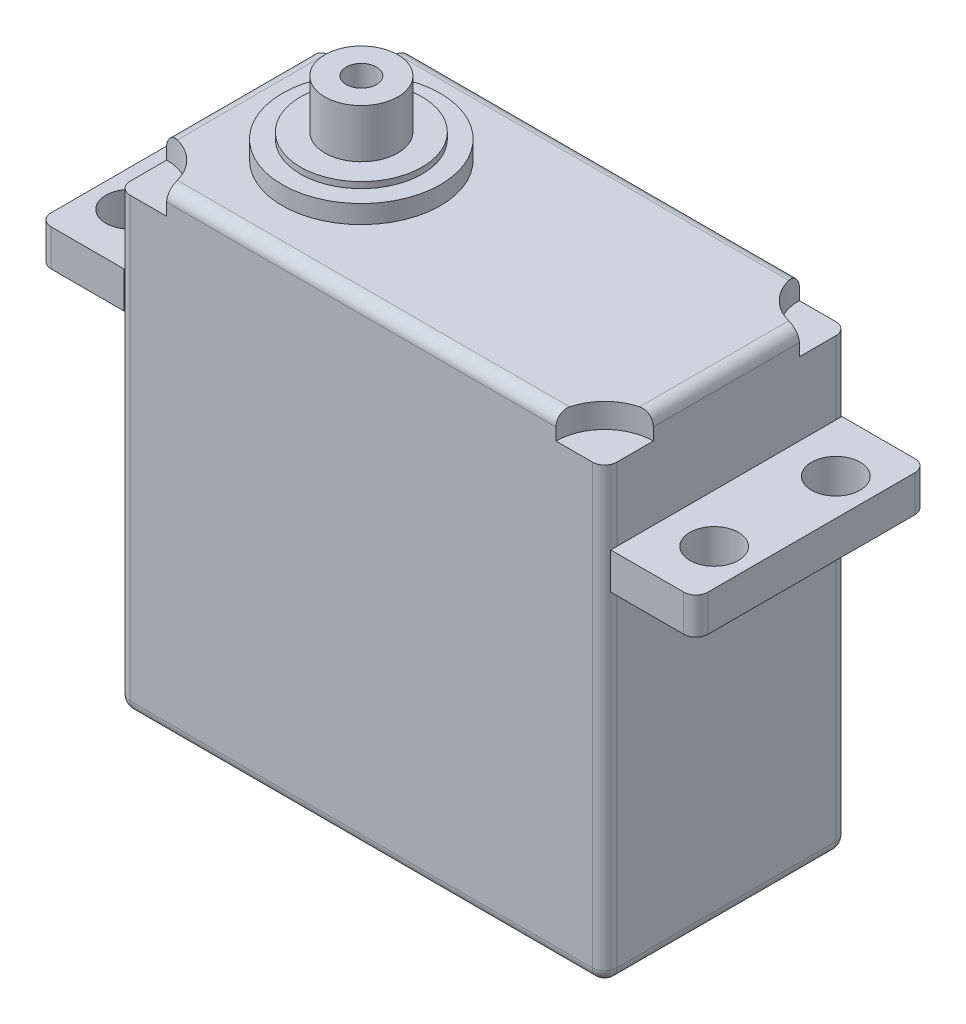
from build123d import *

# Parameters (mm, degrees)
SKETCH_2_W                = 40
SKETCH_2_H                = 39
EXTRUDE_1_DEPTH           = 10
FILLET_1_R                = 1
SKETCH_6_R                = 4
CUT_EXTRUDE_1_DEPTH       = 2
HOLE_WIZARD_2_0_2_2_D     = 2
HOLE_WIZARD_2_0_2_2_DEPTH = 10
HOLE_WIZARD_2_0_2_2_TIP   = 0.600860619
EXTRUDE_START             = -8
SKETCH_16_W               = 7
SKETCH_16_H               = 19
SKETCH_16_R               = 2
EXTRUDE_2_DEPTH           = 3
SKETCH_17_R               = 6.5
EXTRUDE_3_DEPTH           = 1.5
SKETCH_18_R               = 5
EXTRUDE_4_DEPTH           = 0.5
SKETCH_19_R               = 3
EXTRUDE_5_DEPTH           = 4
FILLET_2_R                = 1
HOLE_WIZARD_M3_1_D        = 2.5
HOLE_WIZARD_M3_1_DEPTH    = 5.55
HOLE_WIZARD_M3_1_TIP      = 0.751075774


with BuildPart() as part:
    # 草图2 → 凸台-拉伸1 (new, symmetric)
    with BuildSketch(Plane.XY):
        with Locations((20, -19.5)):
            Rectangle(SKETCH_2_W, SKETCH_2_H)
    extrude(amount=EXTRUDE_1_DEPTH, both=True)

    # 圆角1
    fillet_1_edges = [part.edges().sort_by_distance(p)[0] for p in [
        (40, -19.5, 10),
        (20, 0, 10),
        (0, -19.5, 10),
        (20, 0, -10),
        (40, -19.5, -10),
        (20, -39, -10),
        (0, -19.5, -10),
        (20, -39, 10),
        (0, 0, 0),
        (40, 0, 0),
        (40, -39, 0),
        (0, -39, 0),
    ]]
    fillet(fillet_1_edges, radius=FILLET_1_R)

    # 草图6 → 切除-拉伸1 (cut)
    with BuildSketch(Plane.XZ):
        with Locations((0, 10)):
            Circle(SKETCH_6_R)
        with Locations((40, 10)):
            Circle(SKETCH_6_R)
        with Locations((40, -10)):
            Circle(SKETCH_6_R)
        with Locations((0, -10)):
            Circle(SKETCH_6_R)
    extrude(amount=CUT_EXTRUDE_1_DEPTH, mode=Mode.SUBTRACT)

    # Ø2.0 (2) 直径孔2
    with Locations(Plane(origin=(0, -39, 0), x_dir=(-1, 0, 0), z_dir=(0, -1, 0))):
        with Locations((-37.5, 7.5), (-37.5, -7.5), (-2.5, 7.5), (-2.5, -7.5)):
            Hole(HOLE_WIZARD_2_0_2_2_D / 2, depth=HOLE_WIZARD_2_0_2_2_DEPTH)
            with Locations((0, 0, -(HOLE_WIZARD_2_0_2_2_DEPTH + HOLE_WIZARD_2_0_2_2_TIP / 2))):  # 118° drill point
                Cone(0, HOLE_WIZARD_2_0_2_2_D / 2, HOLE_WIZARD_2_0_2_2_TIP, mode=Mode.SUBTRACT)

    # 草图16 → 凸台-拉伸2 (add)
    # profile 1 of 2: a face of its own
    with BuildSketch(Plane(origin=(0, 0, 0), x_dir=(1, 0, 0), z_dir=(0, 1, 0)).offset(EXTRUDE_START)):
        with Locations((-3.5, 0)):
            Rectangle(SKETCH_16_W, SKETCH_16_H)
        with Locations(Location((-4, -5, 0), (0, 0, 270))):
            Circle(SKETCH_16_R, mode=Mode.SUBTRACT)
        with Locations(Location((-4, 5, 0), (0, 0, 270))):
            Circle(SKETCH_16_R, mode=Mode.SUBTRACT)
    # profile 2 of 2: a face of its own
    with BuildSketch(Plane(origin=(0, 0, 0), x_dir=(1, 0, 0), z_dir=(0, 1, 0)).offset(EXTRUDE_START)):
        with Locations((43.5, 0)):
            Rectangle(SKETCH_16_W, SKETCH_16_H)
        with Locations(Location((44, 5, 0), (0, 0, 90))):
            Circle(SKETCH_16_R, mode=Mode.SUBTRACT)
        with Locations(Location((44, -5, 0), (0, 0, 90))):
            Circle(SKETCH_16_R, mode=Mode.SUBTRACT)
    extrude(amount=-EXTRUDE_2_DEPTH)

    # 草图17 → 凸台-拉伸3 (add)
    with BuildSketch(Plane(origin=(0, 0, 0), x_dir=(1, 0, 0), z_dir=(0, 1, 0))):
        with Locations(Location((10, 0, 0), (0, 0, 90))):
            Circle(SKETCH_17_R)
    extrude(amount=EXTRUDE_3_DEPTH)

    # 草图18 → 凸台-拉伸4 (add)
    with BuildSketch(Plane(origin=(0, 1.5, 0), x_dir=(1, 0, 0), z_dir=(0, 1, 0))):
        with Locations(Location((10, 0, 0), (0, 0, 270))):
            Circle(SKETCH_18_R)
    extrude(amount=EXTRUDE_4_DEPTH)

    # 草图19 → 凸台-拉伸5 (add)
    with BuildSketch(Plane(origin=(0, 2, 0), x_dir=(1, 0, 0), z_dir=(0, 1, 0))):
        with Locations(Location((10, 0, 0), (0, 0, 270))):
            Circle(SKETCH_19_R)
    extrude(amount=EXTRUDE_5_DEPTH)

    # 圆角2
    fillet_2_edges = [part.edges().sort_by_distance(p)[0] for p in [
        (-7, -9.5, 9.5),
        (-7, -9.5, -9.5),
        (47, -9.5, 9.5),
        (47, -9.5, -9.5),
    ]]
    fillet(fillet_2_edges, radius=FILLET_2_R)

    # M3 螺纹孔1
    with Locations(Plane(origin=(0, 6, 0), x_dir=(1, 0, 0), z_dir=(0, 1, 0))):
        with Locations((10, 0)):
            Hole(HOLE_WIZARD_M3_1_D / 2, depth=HOLE_WIZARD_M3_1_DEPTH)
            with Locations((0, 0, -(HOLE_WIZARD_M3_1_DEPTH + HOLE_WIZARD_M3_1_TIP / 2))):  # 118° drill point
                Cone(0, HOLE_WIZARD_M3_1_D / 2, HOLE_WIZARD_M3_1_TIP, mode=Mode.SUBTRACT)


solid = part.part
